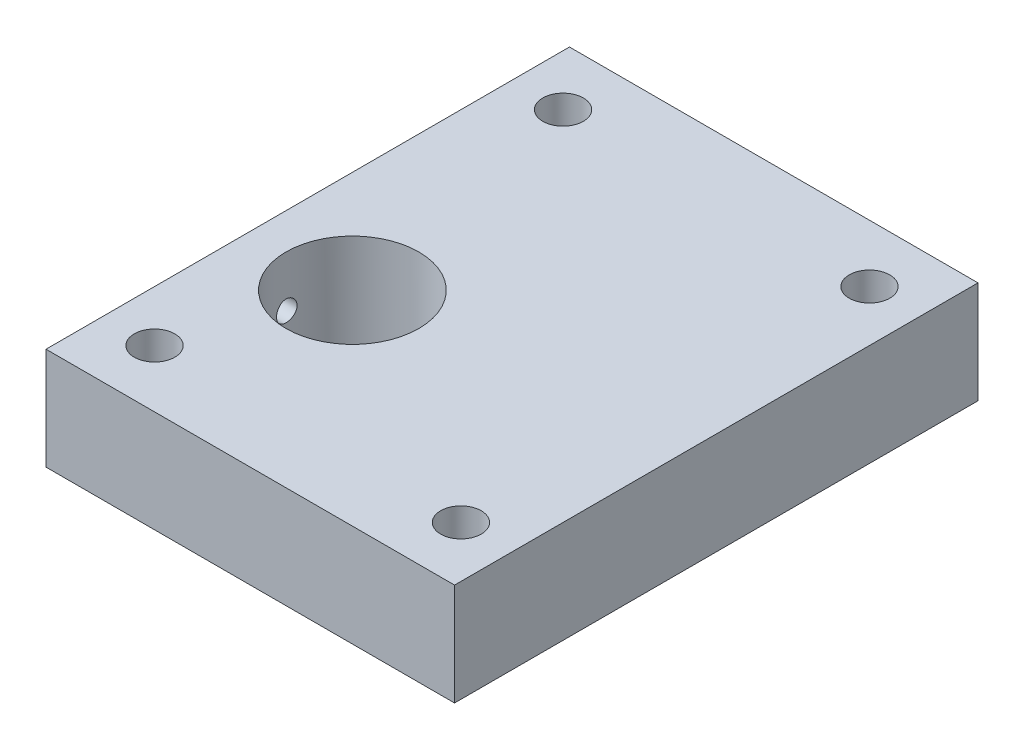
from build123d import *

# Parameters (mm, degrees)
SKETCH1_W                   = 101.6
SKETCH1_H                   = 130.175
BOSS_EXTRUDE1_DEPTH         = 12.7
CUT_EXTRUDE1_DEPTH          = 87.383925914
CUT_EXTRUDE1_DEPTH_BACK     = 87.383925914
SKETCH2_R                   = 16.51
F_3_8_CLEARANCE_HOLE1_D     = 10.0838
F_1_4_20_TAPPED_HOLE1_D     = 5.1054
F_1_4_20_TAPPED_HOLE1_DEPTH = 16.51
F_1_4_20_TAPPED_HOLE1_TIP   = 1.533816902


with BuildPart() as part:
    # Sketch1 → Boss-Extrude1 (new, symmetric)
    with BuildSketch(Plane(origin=(0, 0, 0), x_dir=(1, 0, 0), z_dir=(0, 1, 0))):
        Rectangle(SKETCH1_W, SKETCH1_H)
    extrude(amount=BOSS_EXTRUDE1_DEPTH, both=True)

    # Sketch2 → Cut-Extrude1 (cut, two sides: drawn at the far end of the back side and taken through both)
    with BuildSketch(Plane(origin=(0, 12.7, 0), x_dir=(1, 0, 0), z_dir=(0, 1, 0)).offset(-CUT_EXTRUDE1_DEPTH_BACK)):
        with Locations(Location((-25.4, -14.2875, 0), (0, 0, 270))):
            Circle(SKETCH2_R)
    extrude(amount=CUT_EXTRUDE1_DEPTH + CUT_EXTRUDE1_DEPTH_BACK, mode=Mode.SUBTRACT)

    # 3/8 Clearance Hole1 (through all)
    with Locations(Plane(origin=(0, -12.7, 0), x_dir=(-1, 0, 0), z_dir=(0, -1, 0))):
        with Locations((-38.1, 50.8), (38.1, 50.8), (38.1, -50.8), (-38.1, -50.8)):
            Hole(F_3_8_CLEARANCE_HOLE1_D / 2)

    # 1/4-20 Tapped Hole1
    with Locations(Plane.ZY.offset(50.8)):
        with Locations((14.2875, 0)):
            Hole(F_1_4_20_TAPPED_HOLE1_D / 2, depth=F_1_4_20_TAPPED_HOLE1_DEPTH)
            with Locations((0, 0, -(F_1_4_20_TAPPED_HOLE1_DEPTH + F_1_4_20_TAPPED_HOLE1_TIP / 2))):  # 118° drill point
                Cone(0, F_1_4_20_TAPPED_HOLE1_D / 2, F_1_4_20_TAPPED_HOLE1_TIP, mode=Mode.SUBTRACT)


solid = part.part
